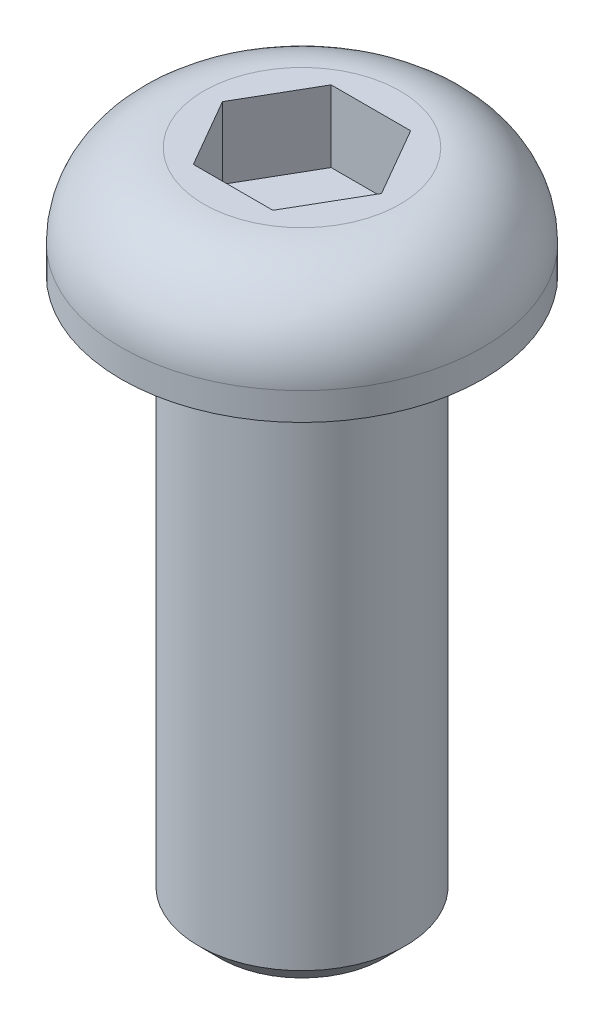
from build123d import *

# Parameters (mm, degrees)
CUT_EXTRUDE1_DEPTH = 2.08
FILLET1_R          = 0.25
CHAMFER1_SIZE      = 0.625


with BuildPart() as part:
    # Sketch1 → Revolve1 (revolve)
    with BuildSketch(Plane.XY, mode=Mode.PRIVATE) as revolve1_sk:
        with BuildLine():
            Line((0, 0), (2.85, 0))
            ThreePointArc((2.85, 0), (4.547056275, -0.702943725), (5.25, -2.4))
            Line((5.25, -2.4), (5.25, -3.2))
            Line((5.25, -3.2), (3, -3.2))
            Line((3, -3.2), (3, -19.2))
            Line((3, -19.2), (0, -19.2))
            Line((0, -19.2), (0, 0))
        make_face()
    revolve(revolve1_sk.sketch.rotate(Axis((0, 5, 0), (0, -1, 0)), 180), axis=Axis((0, 5, 0), (0, -1, 0)))

    # Sketch2 → Cut-Extrude1 (cut)
    with BuildSketch(Plane(origin=(0, 0, 0), x_dir=(1, 0, 0), z_dir=(0, 1, 0))):
        Polygon((2.309401077, 0), (1.154700538, 2), (-1.154700538, 2), (-2.309401077, 0), (-1.154700538, -2), (1.154700538, -2), align=None)
    extrude(amount=-CUT_EXTRUDE1_DEPTH, mode=Mode.SUBTRACT)

    # Fillet1
    fillet1_edges = [part.edges().sort_by_distance(p)[0] for p in [
        (3, -3.2, 0),
    ]]
    fillet(fillet1_edges, radius=FILLET1_R)

    # Chamfer1
    chamfer1_edges = [part.edges().sort_by_distance(p)[0] for p in [
        (3, -19.2, 0),
    ]]
    chamfer(chamfer1_edges, length=CHAMFER1_SIZE)


solid = part.part
